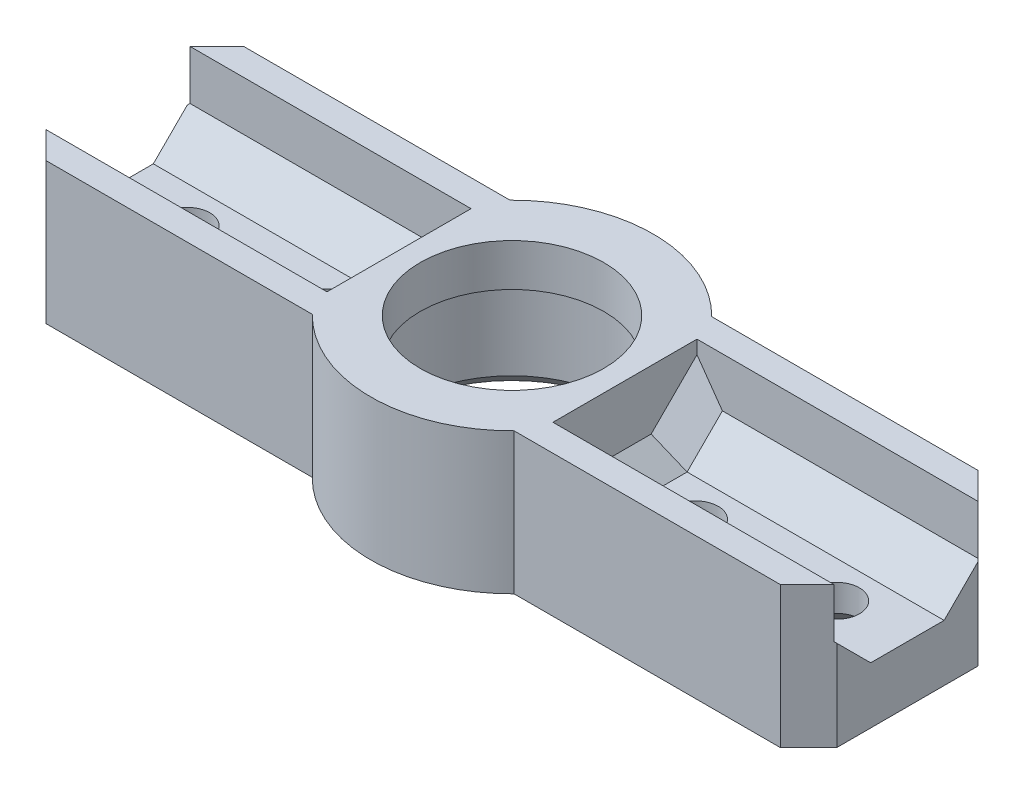
from build123d import *

# Parameters (mm, degrees)
BOSS_EXTRU_1_DEPTH           = 10
ESQUISSE2_W                  = 10.2
ESQUISSE2_H                  = 6
ENL_V_MAT_EXTRU_1_DEPTH      = 20
CHANFREIN1_SIZE              = 2.5
CHANFREIN2_SIZE              = 1.8
CHANFREIN1_OF_SYM_TRIE1_SIZE = 2.5
CHANFREIN2_OF_SYM_TRIE1_SIZE = 1.8
ESQUISSE3_R                  = 6.5
ENL_V_MAT_EXTRU_2_DEPTH      = 32.368774283
ESQUISSE4_R                  = 7.5
ENL_V_MAT_EXTRU_3_DEPTH      = 7
CHANFREIN3_SIZE              = 1
ESQUISSE5_R                  = 1.6
ENL_V_MAT_EXTRU_4_DEPTH      = 7
CHANFREIN4_SIZE              = 2.1
CHANFREIN5_SIZE              = 2


with BuildPart() as part:
    # Esquisse1 → Boss.-Extru.1 (new body)
    with BuildSketch(Plane(origin=(0, 0, 0), x_dir=(1, 0, 0), z_dir=(0, 1, 0))):
        with BuildLine():
            Line((7.141428429, 7), (28, 7))
            Line((28, 7), (28, -7))
            Line((28, -7), (7.141428429, -7))
            ThreePointArc((7.141428429, -7), (0, -10), (-7.141428429, -7))
            Line((-7.141428429, -7), (-28, -7))
            Line((-28, -7), (-28, 7))
            Line((-28, 7), (-7.141428429, 7))
            ThreePointArc((-7.141428429, 7), (0, 10), (7.141428429, 7))
        make_face()
    extrude(amount=BOSS_EXTRU_1_DEPTH)

    # Esquisse2 → Enlèv. mat.-Extru.1 (cut)
    with BuildSketch(Plane.ZY.offset(28)):
        with Locations((0, 7)):
            Rectangle(ESQUISSE2_W, ESQUISSE2_H)
    enl_v_mat_extru_1 = extrude(amount=-ENL_V_MAT_EXTRU_1_DEPTH, mode=Mode.SUBTRACT)

    # Chanfrein1
    chanfrein1_edges = [part.edges().sort_by_distance(p)[0] for p in [
        (-18, 4, -5.1),
        (-18, 4, 5.1),
    ]]
    chamfer(chanfrein1_edges, length=CHANFREIN1_SIZE)

    # Chanfrein2
    chanfrein2_edges = [part.edges().sort_by_distance(p)[0] for p in [
        (-8, 4, 0),
        (-8, 5.25, -3.85),
        (-8, 5.25, 3.85),
    ]]
    chamfer(chanfrein2_edges, length=CHANFREIN2_SIZE)

    # Symétrie1: Enlèv. mat.-Extru.1 across plane
    add(enl_v_mat_extru_1.mirror(Plane(origin=(0, 0, 0), x_dir=(0, 0, 1), z_dir=(1, 0, 0))), mode=Mode.SUBTRACT)

    # Chanfrein1 of Symétrie1
    chanfrein1_of_sym_trie1_edges = [part.edges().sort_by_distance(p)[0] for p in [
        (18, 4, -5.1),
        (18, 4, 5.1),
    ]]
    chamfer(chanfrein1_of_sym_trie1_edges, length=CHANFREIN1_OF_SYM_TRIE1_SIZE)

    # Chanfrein2 of Symétrie1
    chanfrein2_of_sym_trie1_edges = [part.edges().sort_by_distance(p)[0] for p in [
        (8, 4, 0),
        (8, 5.25, -3.85),
        (8, 5.25, 3.85),
    ]]
    chamfer(chanfrein2_of_sym_trie1_edges, length=CHANFREIN2_OF_SYM_TRIE1_SIZE)

    # Esquisse3 → Enlèv. mat.-Extru.2 (cut, through all)
    with BuildSketch(Plane.XZ):
        with Locations(Location((0, 0, 0), (0, 0, 270))):
            Circle(ESQUISSE3_R)
    extrude(amount=-ENL_V_MAT_EXTRU_2_DEPTH, mode=Mode.SUBTRACT)

    # Esquisse4 → Enlèv. mat.-Extru.3 (cut)
    with BuildSketch(Plane.XZ):
        with Locations(Location((0, 0, 0), (0, 0, 270))):
            Circle(ESQUISSE4_R)
    extrude(amount=-ENL_V_MAT_EXTRU_3_DEPTH, mode=Mode.SUBTRACT)

    # Chanfrein3
    chanfrein3_edges = [part.edges().sort_by_distance(p)[0] for p in [
        (0, 0, 7.5),
    ]]
    chamfer(chanfrein3_edges, length=CHANFREIN3_SIZE)

    # Esquisse5 → Enlèv. mat.-Extru.4 (cut)
    with BuildSketch(Plane.XZ):
        with Locations(Location((-23, 0, 0), (0, 0, 270))):
            Circle(ESQUISSE5_R)
        with Locations(Location((-13, 0, 0), (0, 0, 270))):
            Circle(ESQUISSE5_R)
        with Locations(Location((13, 0, 0), (0, 0, 270))):
            Circle(ESQUISSE5_R)
        with Locations(Location((23, 0, 0), (0, 0, 270))):
            Circle(ESQUISSE5_R)
    extrude(amount=-ENL_V_MAT_EXTRU_4_DEPTH, mode=Mode.SUBTRACT)

    # Chanfrein4
    chanfrein4_edges = [part.edges().sort_by_distance(p)[0] for p in [
        (-23, 0, 1.6),
        (-13, 0, 1.6),
        (13, 0, 1.6),
        (23, 0, 1.6),
    ]]
    chamfer(chanfrein4_edges, length=CHANFREIN4_SIZE)

    # Chanfrein5
    chanfrein5_edges = [part.edges().sort_by_distance(p)[0] for p in [
        (28, 5, -7),
        (28, 5, 7),
        (-28, 5, -7),
        (-28, 5, 7),
    ]]
    chamfer(chanfrein5_edges, length=CHANFREIN5_SIZE)


solid = part.part
